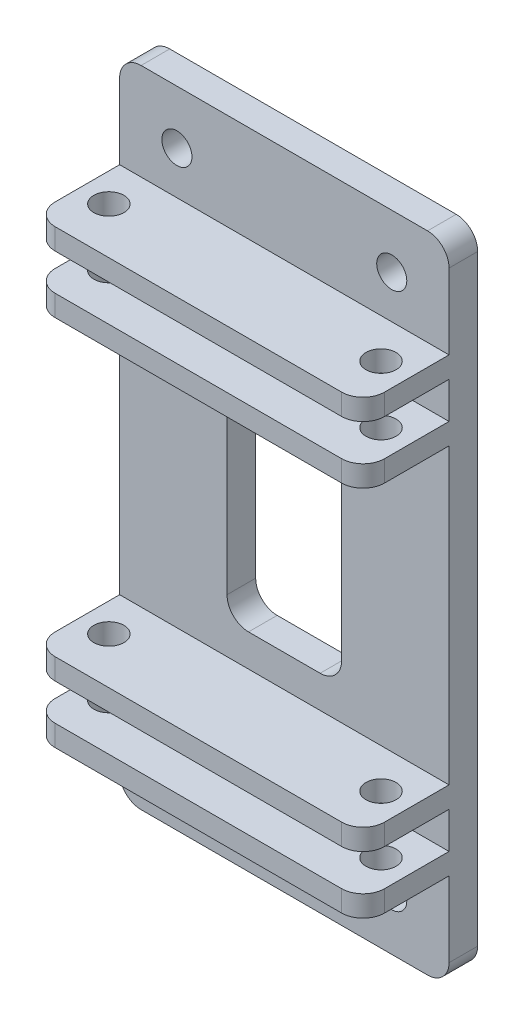
from build123d import *

# Parameters (mm, degrees)
EXTRUDE_1_DEPTH     = 4
SKETCH_2_R          = 2.1
CUT_EXTRUDE_1_DEPTH = 4
SKETCH_3_W          = 46
SKETCH_3_H          = 2.95
EXTRUDE_2_DEPTH     = 12
FILLET_1_R          = 3
SKETCH_4_R          = 2.1
CUT_EXTRUDE_2_DEPTH = 82.469319379
CUT_EXTRUDE_3_DEPTH = 10


with BuildPart() as part:
    # 草图1 → 凸台-拉伸1 (new body)
    with BuildSketch(Plane.XY):
        with BuildLine():
            Line((-20, -45), (20, -45))
            ThreePointArc((20, -45), (22.121320344, -44.121320344), (23, -42))
            Line((23, -42), (23, 42))
            ThreePointArc((23, 42), (22.121320344, 44.121320344), (20, 45))
            Line((20, 45), (-20, 45))
            ThreePointArc((-20, 45), (-22.121320344, 44.121320344), (-23, 42))
            Line((-23, 42), (-23, -42))
            ThreePointArc((-23, -42), (-22.121320344, -44.121320344), (-20, -45))
        make_face()
    extrude(amount=EXTRUDE_1_DEPTH)

    # 草图2 → 切除-拉伸1 (cut)
    with BuildSketch(Plane.XY.offset(4)):
        with Locations((15, -37.5)):
            Circle(SKETCH_2_R)
        with Locations((-15, -37.5)):
            Circle(SKETCH_2_R)
        with Locations((-15, 37.5)):
            Circle(SKETCH_2_R)
        with Locations((15, 37.5)):
            Circle(SKETCH_2_R)
    extrude(amount=-CUT_EXTRUDE_1_DEPTH, mode=Mode.SUBTRACT)

    # 草图3 → 凸台-拉伸2 (add)
    with BuildSketch(Plane.XY.offset(4)):
        with Locations((0, 30.025)):
            Rectangle(SKETCH_3_W, SKETCH_3_H)
        with Locations((0, 21.975)):
            Rectangle(SKETCH_3_W, SKETCH_3_H)
    extrude_2 = extrude(amount=EXTRUDE_2_DEPTH)

    # 镜向1: 凸台-拉伸2 across plane
    add(extrude_2.mirror(Plane.ZX))

    # 圆角1
    fillet_1_edges = [part.edges().sort_by_distance(p)[0] for p in [
        (-23, 30.025, 16),
        (23, 30.025, 16),
        (-23, 21.975, 16),
        (23, 21.975, 16),
        (-23, -30.025, 16),
        (23, -30.025, 16),
        (23, -21.975, 16),
        (-23, -21.975, 16),
    ]]
    fillet(fillet_1_edges, radius=FILLET_1_R)

    # 草图4 → 切除-拉伸2 (cut, through all)
    with BuildSketch(Plane.XZ.offset(31.5)):
        with Locations(Location((19, 9.5, 0), (0, 0, 90))):
            Circle(SKETCH_4_R)
        with Locations(Location((-19, 9.5, 0), (0, 0, 90))):
            Circle(SKETCH_4_R)
    extrude(amount=-CUT_EXTRUDE_2_DEPTH, mode=Mode.SUBTRACT)

    # 草图5 → 切除-拉伸3 (cut)
    with BuildSketch(Plane(origin=(0, 0, 0), x_dir=(-1, 0, 0), z_dir=(0, 0, -1))):
        with BuildLine():
            Line((-5, -16), (5, -16))
            ThreePointArc((5, -16), (7.121320344, -15.121320344), (8, -13))
            Line((8, -13), (8, 13))
            ThreePointArc((8, 13), (7.121320344, 15.121320344), (5, 16))
            Line((5, 16), (-5, 16))
            ThreePointArc((-5, 16), (-7.121320344, 15.121320344), (-8, 13))
            Line((-8, 13), (-8, -13))
            ThreePointArc((-8, -13), (-7.121320344, -15.121320344), (-5, -16))
        make_face()
    extrude(amount=-CUT_EXTRUDE_3_DEPTH, mode=Mode.SUBTRACT)


solid = part.part
